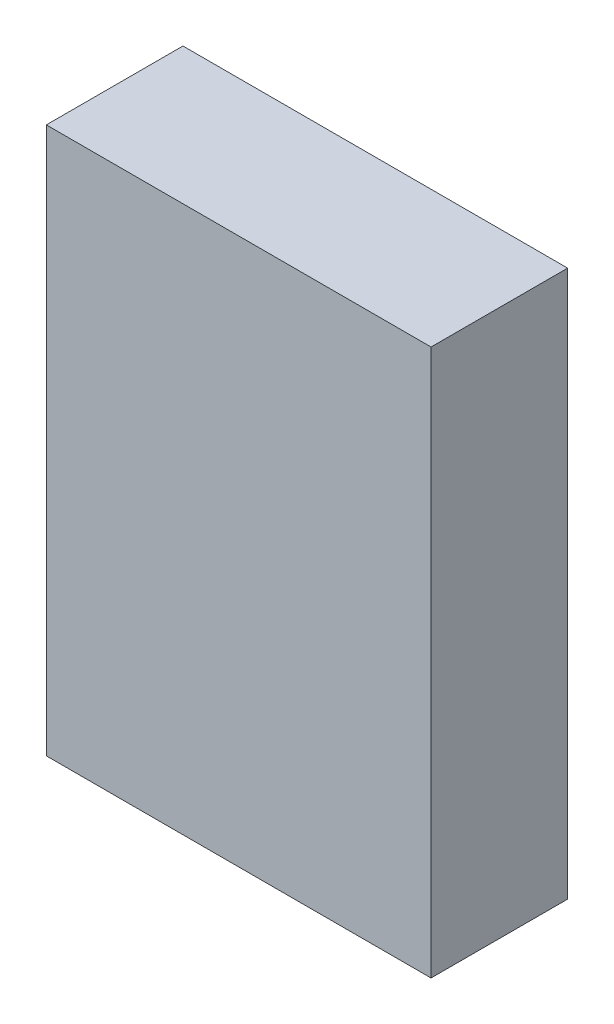
from build123d import *

# Parameters (mm, degrees)
SKETCH1_W           = 140.8
SKETCH1_H           = 200
BOSS_EXTRUDE1_DEPTH = 50


with BuildPart() as part:
    # Sketch1 → Boss-Extrude1 (new body)
    with BuildSketch(Plane.XY):
        with Locations((-70.4, -100)):
            Rectangle(SKETCH1_W, SKETCH1_H)
    extrude(amount=BOSS_EXTRUDE1_DEPTH)


solid = part.part
